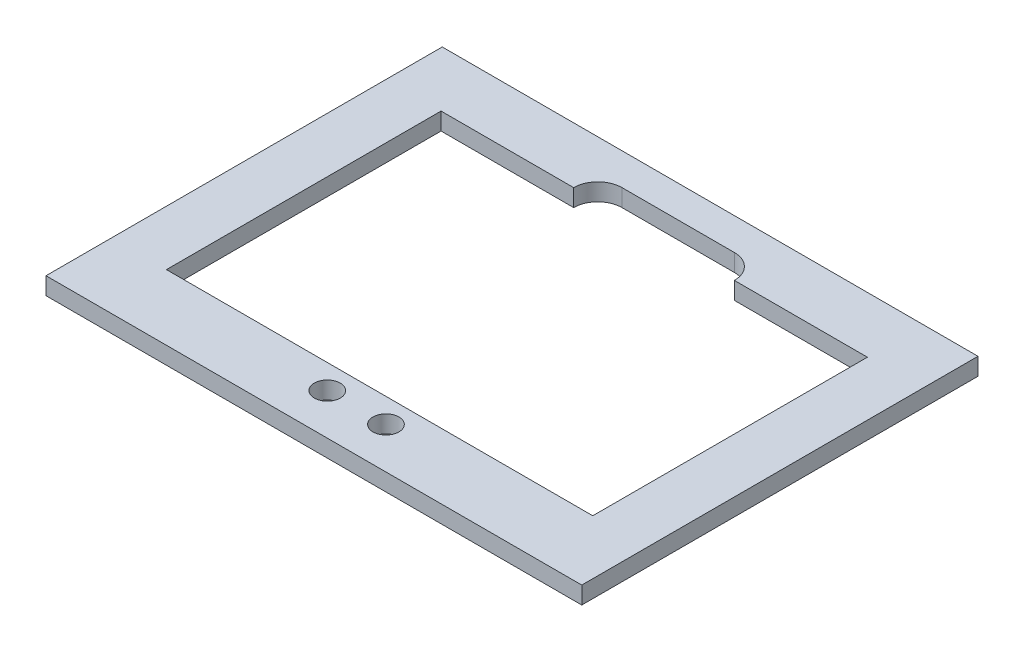
from build123d import *

# Parameters (mm, degrees)
SKETCH1_W           = 78.53
SKETCH1_H           = 58.08
SKETCH1_R           = 1.905
SKETCH1_W_2         = 62.491610006
SKETCH1_H_2         = 40.253760829
BOSS_EXTRUDE1_DEPTH = 2.54
CUT_EXTRUDE1_DEPTH  = 2.54


with BuildPart() as part:
    # Sketch1 → Boss-Extrude1 (new body)
    with BuildSketch(Plane(origin=(0, 0, 0), x_dir=(1, 0, 0), z_dir=(0, 1, 0))):
        with Locations((-0.329128556, 0.204655215)):
            Rectangle(SKETCH1_W, SKETCH1_H)
        with Locations(Location((-4.402236218, -22.797237123, 0), (0, 0, 270))):
            Circle(SKETCH1_R, mode=Mode.SUBTRACT)
        with Locations(Location((4.197763782, -22.797237123, 0), (0, 0, 270))):
            Circle(SKETCH1_R, mode=Mode.SUBTRACT)
        with Locations((-0.298250033, 0.894255625)):
            Rectangle(SKETCH1_W_2, SKETCH1_H_2, mode=Mode.SUBTRACT)
    extrude(amount=BOSS_EXTRUDE1_DEPTH)

    # Sketch2 → Cut-Extrude1 (cut)
    with BuildSketch(Plane(origin=(0, 2.54, 0), x_dir=(1, 0, 0), z_dir=(0, 1, 0))):
        with BuildLine():
            Line((-8.568685341, 24.564329148), (7.910428229, 24.564329148))
            ThreePointArc((7.910428229, 24.564329148), (11.453621336, 21.02113604), (7.910428229, 17.477942933))
            Line((7.910428229, 17.477942933), (-8.568685341, 17.477942933))
            ThreePointArc((-8.568685341, 17.477942933), (-12.111878448, 21.02113604), (-8.568685341, 24.564329148))
        make_face()
    extrude(amount=-CUT_EXTRUDE1_DEPTH, mode=Mode.SUBTRACT)


solid = part.part
